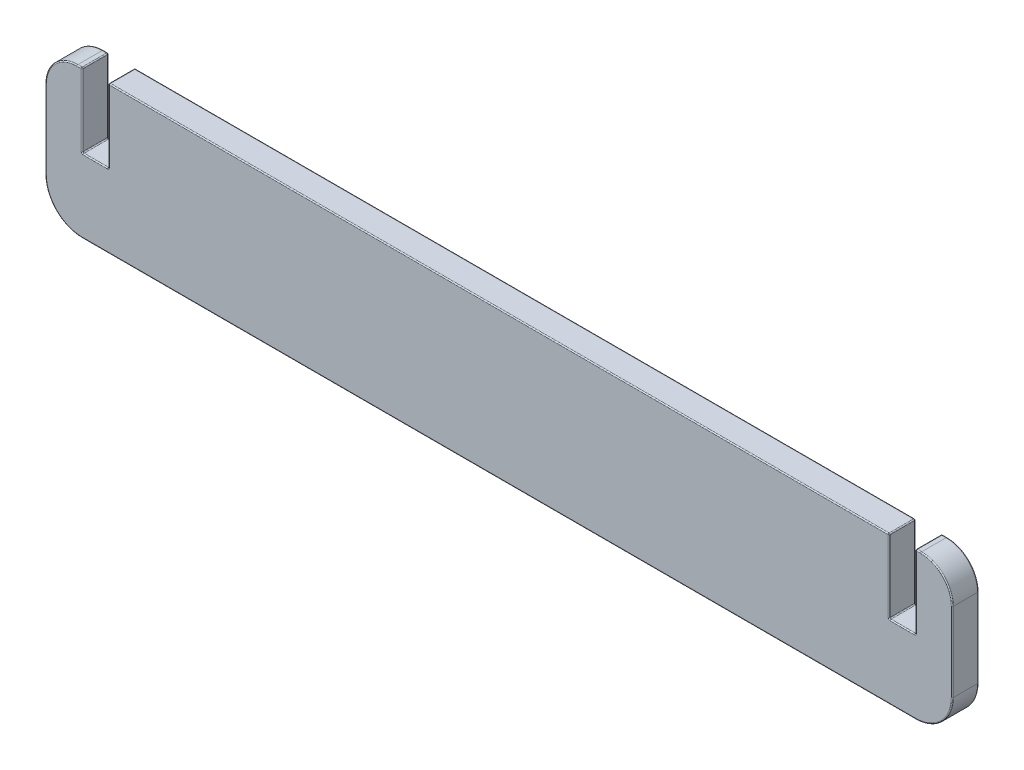
from build123d import *

# Parameters (mm, degrees)
RESSALTO_EXTRUS_O1_DEPTH = 2.5
FILETE1_R                = 0.1


with BuildPart() as part:
    # Esboço1 → Ressalto-extrusão1 (new body)
    with BuildSketch(Plane.XY):
        with BuildLine():
            ThreePointArc((-199.297641475, 72.518779678), (-198.272493356, 70.044033295), (-195.797641475, 69.019139891))
            Line((-195.797641475, 69.019139891), (-116.597641475, 69.019139891))
            ThreePointArc((-116.597641475, 69.019139891), (-114.122789593, 70.044033295), (-113.097641475, 72.518779678))
            Line((-113.097641475, 72.518779678), (-113.097641475, 80.019139873))
            ThreePointArc((-113.097641475, 80.019139873), (-113.976321131, 82.140460216), (-116.097641475, 83.019139873))
            Line((-116.097641475, 83.019139873), (-116.597641475, 83.019139873))
            Line((-116.597641475, 83.019139873), (-116.597641475, 76.019139873))
            Line((-116.597641475, 76.019139873), (-119.097641475, 76.019139873))
            Line((-119.097641475, 76.019139873), (-119.097641475, 83.019139873))
            Line((-119.097641475, 83.019139873), (-135.097641475, 83.019139873))
            Line((-135.097641475, 83.019139873), (-141.097641475, 83.019139873))
            Line((-141.097641475, 83.019139873), (-171.297641475, 83.019139873))
            Line((-171.297641475, 83.019139873), (-177.297641475, 83.019139873))
            Line((-177.297641475, 83.019139873), (-193.297641475, 83.019139873))
            Line((-193.297641475, 83.019139873), (-193.297641475, 76.019139873))
            Line((-193.297641475, 76.019139873), (-195.797641475, 76.019139873))
            Line((-195.797641475, 76.019139873), (-195.797641475, 83.019139873))
            Line((-195.797641475, 83.019139873), (-196.297641475, 83.019139873))
            ThreePointArc((-196.297641475, 83.019139873), (-198.418961818, 82.140460216), (-199.297641475, 80.019139873))
            Line((-199.297641475, 80.019139873), (-199.297641475, 72.518779678))
        make_face()
    extrude(amount=RESSALTO_EXTRUS_O1_DEPTH)

    # Filete1
    filete1_edges = [part.edges().sort_by_distance(p)[0] for p in [
        (-199.297641475, 76.268959775, 2.5),
        (-195.797641475, 79.519139873, 0),
        (-194.547641475, 76.019139873, 0),
        (-198.272493356, 70.044033295, 2.5),
        (-193.297641475, 79.519139873, 0),
        (-156.197641475, 83.019139873, 0),
        (-119.097641475, 79.519139873, 0),
        (-117.847641475, 76.019139873, 0),
        (-116.597641475, 79.519139873, 0),
        (-116.347641475, 83.019139873, 0),
        (-113.976321131, 82.140460216, 0),
        (-113.097641475, 76.268959775, 0),
        (-156.197641475, 69.019139891, 2.5),
        (-114.122789593, 70.044033295, 0),
        (-156.197641475, 69.019139891, 0),
        (-198.272493356, 70.044033295, 0),
        (-199.297641475, 76.268959775, 0),
        (-198.418961818, 82.140460216, 0),
        (-196.047641475, 83.019139873, 0),
        (-114.122789593, 70.044033295, 2.5),
        (-113.097641475, 76.268959775, 2.5),
        (-195.797641475, 83.019139873, 1.25),
        (-195.797641475, 76.019139873, 1.25),
        (-193.297641475, 76.019139873, 1.25),
        (-193.297641475, 83.019139873, 1.25),
        (-119.097641475, 83.019139873, 1.25),
        (-119.097641475, 76.019139873, 1.25),
        (-116.597641475, 76.019139873, 1.25),
        (-116.597641475, 83.019139873, 1.25),
        (-113.976321131, 82.140460216, 2.5),
        (-116.347641475, 83.019139873, 2.5),
        (-116.597641475, 79.519139873, 2.5),
        (-117.847641475, 76.019139873, 2.5),
        (-119.097641475, 79.519139873, 2.5),
        (-196.047641475, 83.019139873, 2.5),
        (-156.197641475, 83.019139873, 2.5),
        (-193.297641475, 79.519139873, 2.5),
        (-194.547641475, 76.019139873, 2.5),
        (-195.797641475, 79.519139873, 2.5),
        (-198.418961818, 82.140460216, 2.5),
    ]]
    fillet(filete1_edges, radius=FILETE1_R)


solid = part.part
